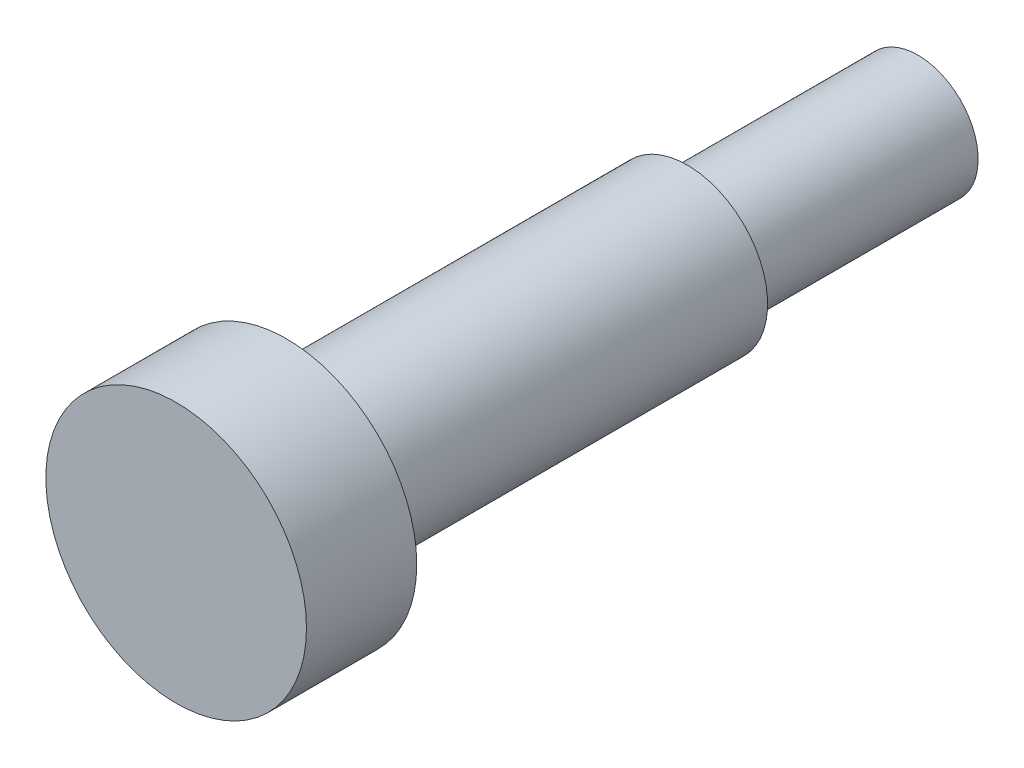
from build123d import *

# Parameters (mm, degrees)
SKETCH_1_R      = 6.5
EXTRUDE_1_DEPTH = 5.5
SKETCH_2_R      = 4
EXTRUDE_2_DEPTH = 20
SKETCH_3_R      = 3
EXTRUDE_3_DEPTH = 11.5


with BuildPart() as part:
    # 草图1 → 凸台-拉伸1 (new body)
    with BuildSketch(Plane.XY):
        Circle(SKETCH_1_R)
    extrude(amount=-EXTRUDE_1_DEPTH)

    # 草图2 → 凸台-拉伸2 (add)
    with BuildSketch(Plane(origin=(0, 0, -5.5), x_dir=(-1, 0, 0), z_dir=(0, 0, -1))):
        Circle(SKETCH_2_R)
    extrude(amount=EXTRUDE_2_DEPTH)

    # 草图3 → 凸台-拉伸3 (add)
    with BuildSketch(Plane(origin=(0, 0, -25.5), x_dir=(-1, 0, 0), z_dir=(0, 0, -1))):
        Circle(SKETCH_3_R)
    extrude(amount=EXTRUDE_3_DEPTH)


solid = part.part
